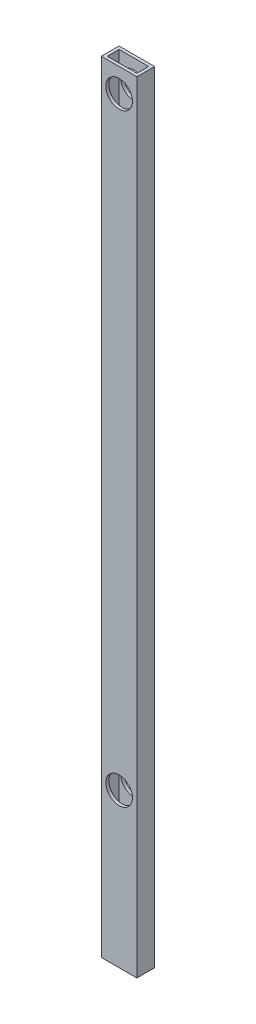
from build123d import *

# Parameters (mm, degrees)
SKETCH1_W           = 38.1
SKETCH1_H           = 19.05
SKETCH1_W_2         = 31.75
SKETCH1_H_2         = 12.7
EXTRUDE_THIN1_DEPTH = 838.2
SKETCH2_R           = 14.2875
CUT_EXTRUDE1_DEPTH  = 840.28168841
SKETCH3_R           = 14.2875
CUT_EXTRUDE2_DEPTH  = 840.28168841


with BuildPart() as part:
    # Sketch1 → Extrude-Thin1 (new body)
    with BuildSketch(Plane(origin=(0, 0, 0), x_dir=(1, 0, 0), z_dir=(0, 1, 0))):
        with Locations((19.05, 9.525)):
            Rectangle(SKETCH1_W, SKETCH1_H)
        with Locations((19.05, 9.525)):
            Rectangle(SKETCH1_W_2, SKETCH1_H_2, mode=Mode.SUBTRACT)
    extrude(amount=EXTRUDE_THIN1_DEPTH)

    # Sketch2 → Cut-Extrude1 (cut, through all)
    with BuildSketch(Plane.XY):
        with Locations((19.05, 165.1)):
            Circle(SKETCH2_R)
    extrude(amount=-CUT_EXTRUDE1_DEPTH, mode=Mode.SUBTRACT)

    # Sketch3 → Cut-Extrude2 (cut, through all)
    with BuildSketch(Plane.XY):
        with Locations((19.05, 812.8)):
            Circle(SKETCH3_R)
    extrude(amount=-CUT_EXTRUDE2_DEPTH, mode=Mode.SUBTRACT)


solid = part.part
